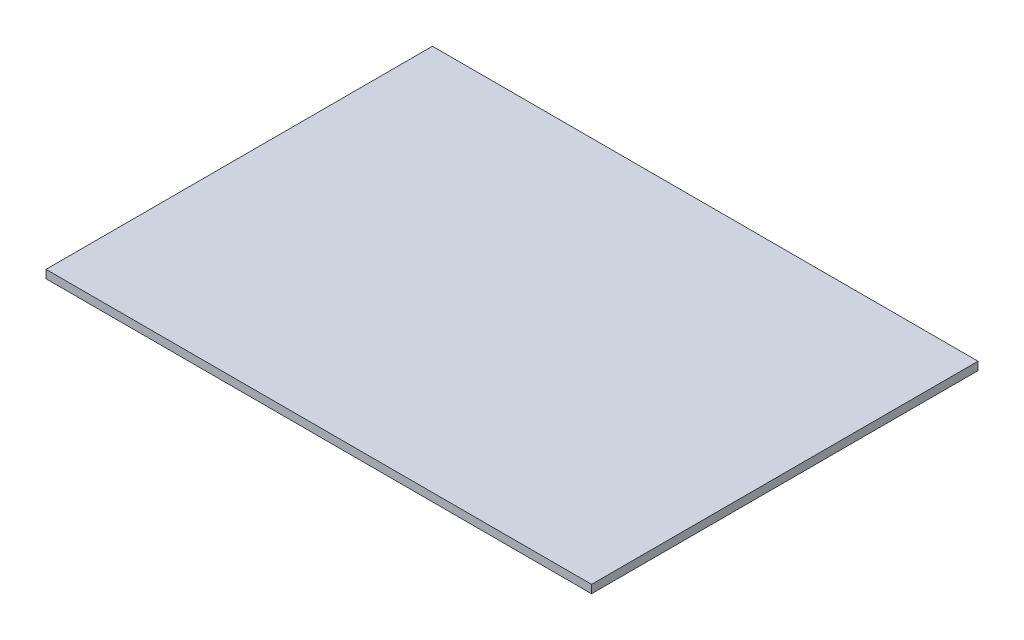
from build123d import *

# Parameters (mm, degrees)
SKETCH1_W           = 1219.2
SKETCH1_H           = 863.6
BOSS_EXTRUDE1_DEPTH = 18.25625


with BuildPart() as part:
    # Sketch1 → Boss-Extrude1 (new body)
    with BuildSketch(Plane(origin=(0, 0, 0), x_dir=(1, 0, 0), z_dir=(0, 1, 0))):
        with Locations((609.6, 431.8)):
            Rectangle(SKETCH1_W, SKETCH1_H)
    extrude(amount=BOSS_EXTRUDE1_DEPTH)


solid = part.part
